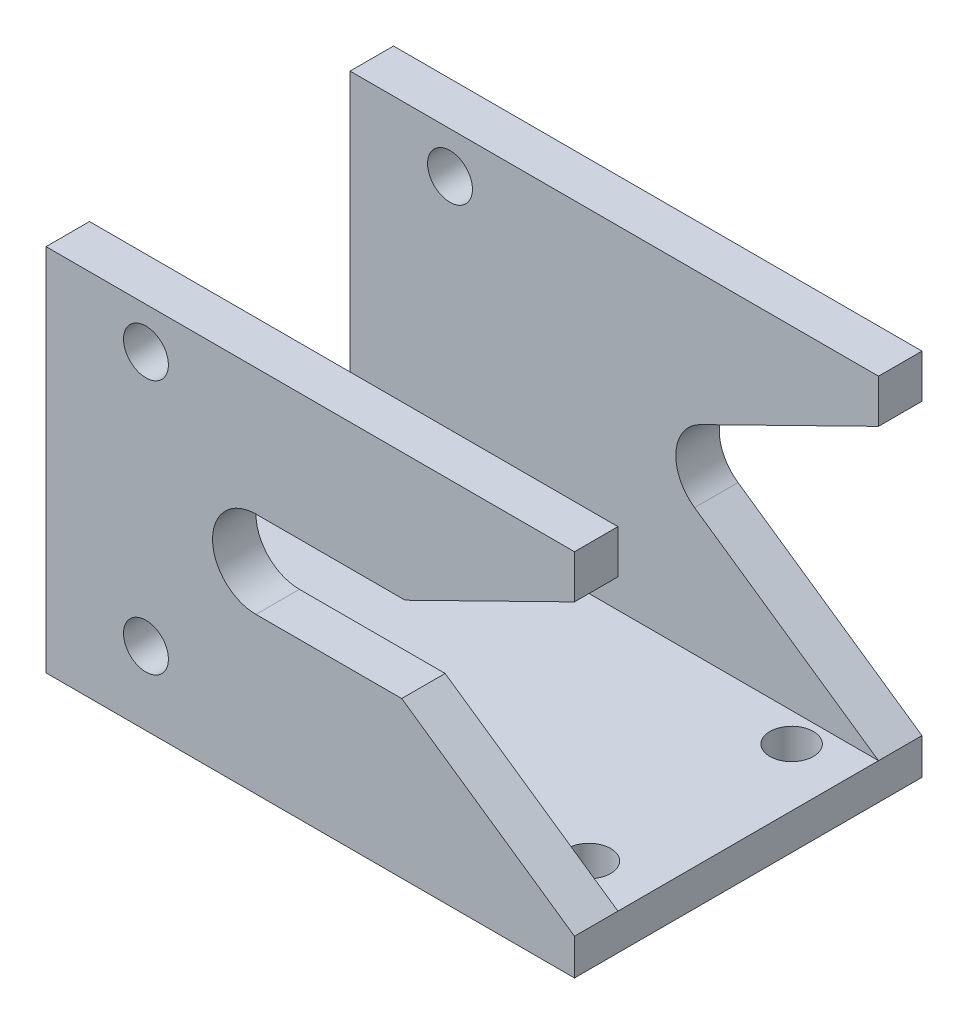
from build123d import *

# Parameters (mm, degrees)
SKETCH1_W           = 36.5
SKETCH1_H           = 24
BOSS_EXTRUDE1_DEPTH = 2.5
SKETCH2_W           = 36.5
SKETCH2_H           = 3
BOSS_EXTRUDE2_DEPTH = 23
SKETCH3_R           = 3
SKETCH3_R_2         = 1.55
CUT_EXTRUDE2_DEPTH  = 51.581617214
CUT_EXTRUDE3_REACH  = 52.582
SKETCH6_R           = 1.5
CUT_EXTRUDE4_DEPTH  = 50.368512232


with BuildPart() as part:
    # Sketch1 → Boss-Extrude1 (new body)
    with BuildSketch(Plane(origin=(0, 0, 0), x_dir=(1, 0, 0), z_dir=(0, 1, 0))):
        with Locations((18.25, 12)):
            Rectangle(SKETCH1_W, SKETCH1_H)
    extrude(amount=BOSS_EXTRUDE1_DEPTH)

    # Sketch2 → Boss-Extrude2 (add)
    with BuildSketch(Plane(origin=(0, 2.5, 0), x_dir=(1, 0, 0), z_dir=(0, 1, 0))):
        with Locations((18.25, 1.5)):
            Rectangle(SKETCH2_W, SKETCH2_H)
        with Locations((18.25, 22.5)):
            Rectangle(SKETCH2_W, SKETCH2_H)
    extrude(amount=BOSS_EXTRUDE2_DEPTH)

    # Sketch3 → Cut-Extrude2 (cut, through all)
    with BuildSketch(Plane.XY):
        with Locations((25.5, 13.75)):
            Circle(SKETCH3_R)
        with BuildLine():
            Line((36.5, 2.5), (36.5, 22.497165255))
            Line((36.5, 22.497165255), (24.17707002, 16.442555713))
            ThreePointArc((24.17707002, 16.442555713), (27.086065897, 16.29644752), (28.5, 13.75))
            ThreePointArc((28.5, 13.75), (26.893321833, 11.093187197), (23.794230487, 11.282136477))
            Line((23.794230487, 11.282136477), (36.5, 2.5))
        make_face()
        with Locations((6.9, 22.65)):
            Circle(SKETCH3_R_2)
        with Locations((6.9, 5.05)):
            Circle(SKETCH3_R_2)
    extrude(amount=-CUT_EXTRUDE2_DEPTH, mode=Mode.SUBTRACT)

    # Sketch5 → Cut-Extrude3 (cut, up to next)
    with BuildSketch(Plane.XY, mode=Mode.PRIVATE) as cut_extrude3_sk1:
        with BuildLine():
            Line((24.17707002, 16.442555713), (24.802810523, 16.75))
            Line((24.802810523, 16.75), (14.5, 16.75))
            ThreePointArc((14.5, 16.75), (11.5, 13.75), (14.5, 10.75))
            Line((14.5, 10.75), (24.564111876, 10.75))
            Line((24.564111876, 10.75), (23.794230487, 11.282136477))
            ThreePointArc((23.794230487, 11.282136477), (22.508221795, 13.971953085), (24.17707002, 16.442555713))
        make_face()
    cut_extrude3_tool1 = extrude(cut_extrude3_sk1.sketch, amount=-CUT_EXTRUDE3_REACH, mode=Mode.PRIVATE) & part.part
    add(cut_extrude3_tool1.solids().sort_by_distance((17.630744, 13.752153, 0))[0], mode=Mode.SUBTRACT)

    # Sketch6 → Cut-Extrude4 (cut, through all)
    with BuildSketch(Plane(origin=(0, 2.5, 0), x_dir=(1, 0, 0), z_dir=(0, 1, 0))):
        with Locations(Location((4, 19, 0), (0, 0, 270))):
            Circle(SKETCH6_R)
        with Locations(Location((32.5, 19, 0), (0, 0, 90))):
            Circle(SKETCH6_R)
        with Locations(Location((32.5, 5, 0), (0, 0, 270))):
            Circle(SKETCH6_R)
        with Locations(Location((4, 5, 0), (0, 0, 90))):
            Circle(SKETCH6_R)
    extrude(amount=-CUT_EXTRUDE4_DEPTH, mode=Mode.SUBTRACT)


solid = part.part
